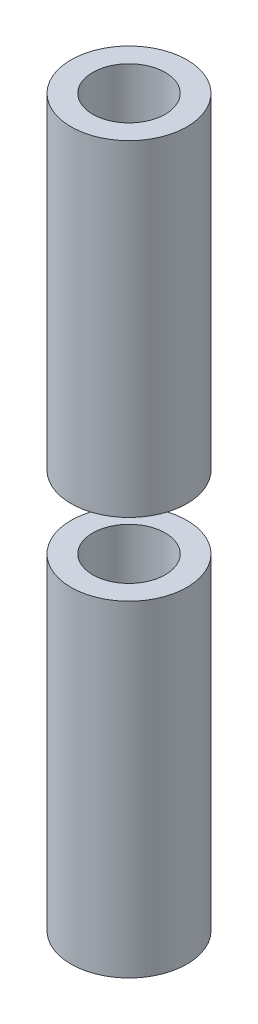
from build123d import *

# Parameters (mm, degrees)
SKETCH2_R               = 2.5
BOSS_EXTRUDE1_DEPTH     = 60
CUT_EXTRUDE1_DEPTH      = 61.104076401
CUT_EXTRUDE1_DEPTH_BACK = 61.104076401
SKETCH4_W               = 16.005108063
SKETCH4_H               = 5
SKETCH5_R               = 4
BOSS_EXTRUDE2_DEPTH     = 27.5
SKETCH6_R               = 4
BOSS_EXTRUDE3_DEPTH     = 27.5
CUT_EXTRUDE2_DEPTH      = 61.266076693
CUT_EXTRUDE2_DEPTH_BACK = 61.266076693
SKETCH7_R               = 2.5
CUT_EXTRUDE3_DEPTH      = 61.266076693
CUT_EXTRUDE3_DEPTH_BACK = 61.266076693
SKETCH8_W               = 8
SKETCH8_H               = 5


with BuildPart() as part:
    # Sketch2 → Boss-Extrude1 (new body)
    with BuildSketch(Plane(origin=(0, 0, 0), x_dir=(1, 0, 0), z_dir=(0, 1, 0))):
        with Locations(Location((0, 0, 0), (0, 0, 270))):
            Circle(SKETCH2_R)
    extrude(amount=BOSS_EXTRUDE1_DEPTH)

    # Sketch4 → Cut-Extrude1 (cut, two sides: drawn at the far end of the back side and taken through both)
    with BuildSketch(Plane(origin=(0, 0, 0), x_dir=(0, 0, -1), z_dir=(1, 0, 0)).offset(-CUT_EXTRUDE1_DEPTH_BACK)):
        with Locations((-1.726998302, 30)):
            Rectangle(SKETCH4_W, SKETCH4_H)
    extrude(amount=CUT_EXTRUDE1_DEPTH + CUT_EXTRUDE1_DEPTH_BACK, mode=Mode.SUBTRACT)


with BuildPart() as cut_extrude1_piece_1:
    # of the separate pieces the step leaves, piece 1, a body of its own (cut_extrude1_pieces)
    add(part.part.solids().sort_by_distance((0, 0, 2.5))[0])

    # Sketch6 → Boss-Extrude3 (add, through all)
    with BuildSketch(Plane(origin=(0, 27.5, 0), x_dir=(1, 0, 0), z_dir=(0, 1, 0))):
        with Locations(Location((0, 0, 0), (0, 0, 90))):
            Circle(SKETCH6_R)
    extrude(amount=-BOSS_EXTRUDE3_DEPTH)


with BuildPart() as cut_extrude1_piece_2:
    # of the separate pieces the step leaves, piece 2, a body of its own (cut_extrude1_pieces)
    add(part.part.solids().sort_by_distance((0, 32.5, 2.5))[0])

    # Sketch5 → Boss-Extrude2 (add, through all)
    with BuildSketch(Plane.XZ.offset(-32.5)):
        with Locations(Location((0, 0, 0), (0, 0, 270))):
            Circle(SKETCH5_R)
    extrude(amount=-BOSS_EXTRUDE2_DEPTH)


with BuildPart() as cut_extrude2_tool:
    # Sketch7 → Cut-Extrude2 (new, two sides: drawn at the far end of the back side and taken through both)
    with BuildSketch(Plane(origin=(0, 60, 0), x_dir=(1, 0, 0), z_dir=(0, 1, 0)).offset(-CUT_EXTRUDE2_DEPTH_BACK)):
        with Locations(Location((0, 0, 0), (0, 0, 270))):
            Circle(SKETCH7_R)
    extrude(amount=CUT_EXTRUDE2_DEPTH + CUT_EXTRUDE2_DEPTH_BACK)


with BuildPart() as cut_extrude1_piece_1_1:
    add(cut_extrude1_piece_1.part)

    # Cut-Extrude2: cut by cut_extrude2_tool
    add(cut_extrude2_tool.part, mode=Mode.SUBTRACT)


with BuildPart() as cut_extrude1_piece_2_1:
    add(cut_extrude1_piece_2.part)

    # Cut-Extrude2: cut by cut_extrude2_tool
    add(cut_extrude2_tool.part, mode=Mode.SUBTRACT)


with BuildPart() as cut_extrude3_tool:
    # Sketch8 → Cut-Extrude3 (new, two sides: drawn at the far end of the back side and taken through both)
    with BuildSketch(Plane(origin=(0, 0, 0), x_dir=(0, 0, -1), z_dir=(1, 0, 0)).offset(-CUT_EXTRUDE3_DEPTH_BACK)):
        with Locations((0, 57.5)):
            Rectangle(SKETCH8_W, SKETCH8_H)
        with Locations((0, 2.5)):
            Rectangle(SKETCH8_W, SKETCH8_H)
    extrude(amount=CUT_EXTRUDE3_DEPTH + CUT_EXTRUDE3_DEPTH_BACK)


with BuildPart() as cut_extrude1_piece_1_2:
    add(cut_extrude1_piece_1_1.part)

    # Cut-Extrude3: cut by cut_extrude3_tool
    add(cut_extrude3_tool.part, mode=Mode.SUBTRACT)


with BuildPart() as cut_extrude1_piece_2_2:
    add(cut_extrude1_piece_2_1.part)

    # Cut-Extrude3: cut by cut_extrude3_tool
    add(cut_extrude3_tool.part, mode=Mode.SUBTRACT)


solid = Compound([cut_extrude1_piece_1_2.part, cut_extrude1_piece_2_2.part])
